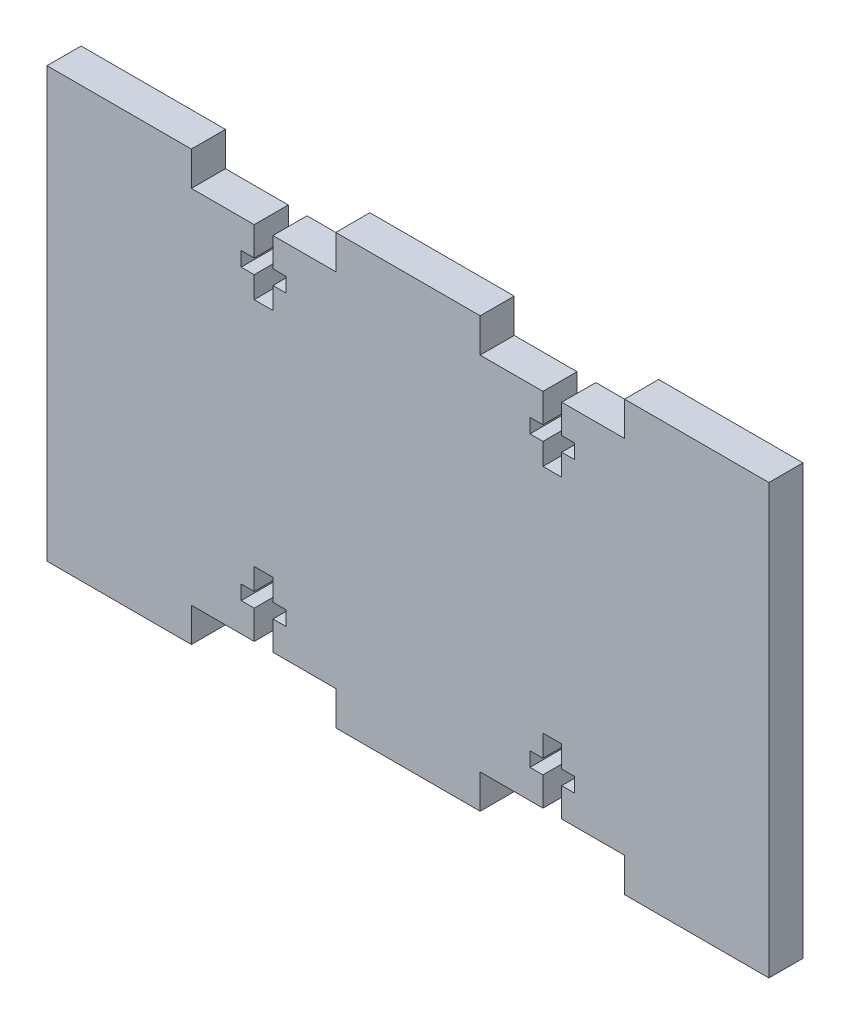
from build123d import *

# Parameters (mm, degrees)
BOSS_EXTRUDE1_DEPTH = 5.9944
CUT_EXTRUDE2_DEPTH  = 5.9944


with BuildPart() as part:
    # Sketch1 → Boss-Extrude1 (new body)
    with BuildSketch(Plane.XY):
        Polygon((25.4, 5.9944), (50.8, 5.9944), (50.8, 0), (76.2, 0), (76.2, 5.9944), (101.6, 5.9944), (101.6, 0), (127, 0), (127, 75.4888), (101.6, 75.4888), (101.6, 69.4944), (76.2, 69.4944), (76.2, 75.4888), (50.8, 75.4888), (50.8, 69.4944), (25.4, 69.4944), (25.4, 75.4888), (0, 75.4888), (0, 0), (25.4, 0), align=None)
    extrude(amount=BOSS_EXTRUDE1_DEPTH)

    # Sketch2 → Cut-Extrude2 (cut)
    with BuildSketch(Plane.XY.offset(5.9944)):
        Polygon((36.449, 69.4944), (36.449, 64.4144), (34.163, 64.4144), (34.163, 61.8744), (36.449, 61.8744), (36.449, 58.0644), (39.751, 58.0644), (39.751, 61.8744), (42.037, 61.8744), (42.037, 64.4144), (39.751, 64.4144), (39.751, 69.4944), align=None)
        Polygon((36.449, 5.9944), (39.751, 5.9944), (39.751, 11.0744), (42.037, 11.0744), (42.037, 13.6144), (39.751, 13.6144), (39.751, 17.4244), (36.449, 17.4244), (36.449, 13.6144), (34.163, 13.6144), (34.163, 11.0744), (36.449, 11.0744), align=None)
        Polygon((90.551, 5.9944), (90.551, 11.0744), (92.837, 11.0744), (92.837, 13.6144), (90.551, 13.6144), (90.551, 17.4244), (87.249, 17.4244), (87.249, 13.6144), (84.963, 13.6144), (84.963, 11.0744), (87.249, 11.0744), (87.249, 5.9944), align=None)
        Polygon((90.551, 69.4944), (87.249, 69.4944), (87.249, 64.4144), (84.963, 64.4144), (84.963, 61.8744), (87.249, 61.8744), (87.249, 58.0644), (90.551, 58.0644), (90.551, 61.8744), (92.837, 61.8744), (92.837, 64.4144), (90.551, 64.4144), align=None)
    extrude(amount=-CUT_EXTRUDE2_DEPTH, mode=Mode.SUBTRACT)


solid = part.part
